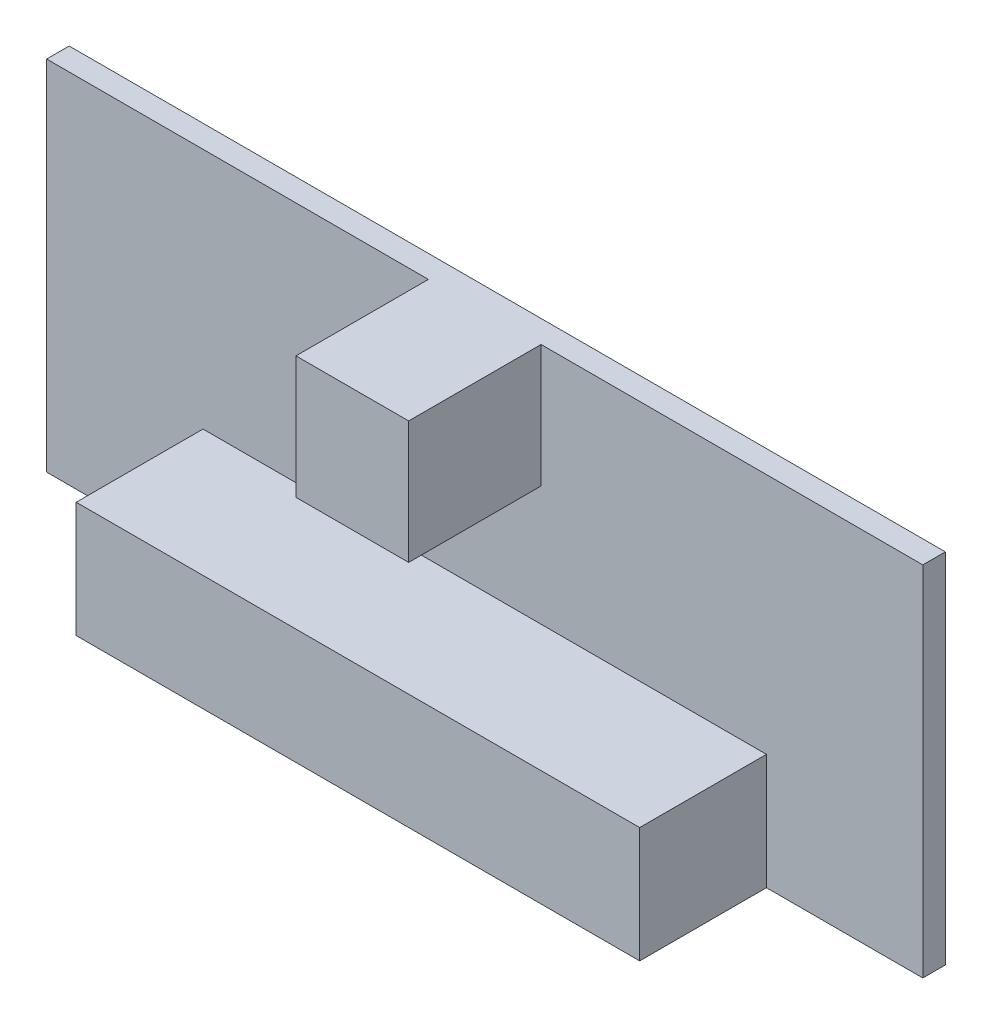
from build123d import *

# Parameters (mm, degrees)
SKETCH1_W           = 62.2
SKETCH1_H           = 25.4
PCB_DEPTH           = 1.6
SKETCH2_W           = 40
SKETCH2_H           = 8.2
SERVO_HEADERS_DEPTH = 9
SKETCH3_W           = 8
SKETCH3_H           = 8.7
V_TERMINAL_DEPTH    = 9.4


with BuildPart() as part:
    # Sketch1 → PCB (new body)
    with BuildSketch(Plane.XY):
        Rectangle(SKETCH1_W, SKETCH1_H)
    extrude(amount=PCB_DEPTH)

    # Sketch2 → Servo_headers (add)
    with BuildSketch(Plane.XY.offset(1.6)):
        with Locations((0, -8.6)):
            Rectangle(SKETCH2_W, SKETCH2_H)
    extrude(amount=SERVO_HEADERS_DEPTH)

    # Sketch3 → V+_terminal (add)
    with BuildSketch(Plane.XY.offset(1.6)):
        with Locations((0, 8.35)):
            Rectangle(SKETCH3_W, SKETCH3_H)
    extrude(amount=V_TERMINAL_DEPTH)


solid = part.part
